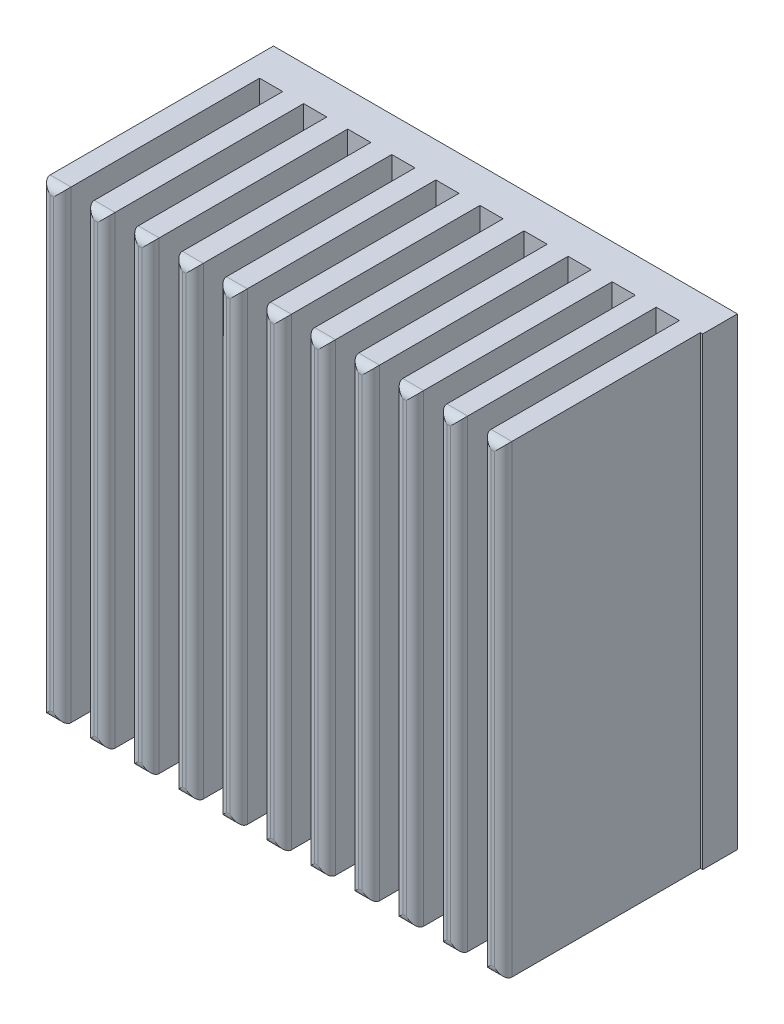
from build123d import *

# Parameters (mm, degrees)
SKETCH1_W           = 40
SKETCH1_H           = 40
BOSS_EXTRUDE1_DEPTH = 3
SKETCH2_W           = 1.8
SKETCH2_H           = 40
BOSS_EXTRUDE2_DEPTH = 17
LPATTERN1_COUNT     = 11
LPATTERN1_PITCH     = 3.8
FILLET1_R           = 0.75


with BuildPart() as part:
    # Sketch1 → Boss-Extrude1 (new body)
    with BuildSketch(Plane.XY):
        Rectangle(SKETCH1_W, SKETCH1_H)
    extrude(amount=BOSS_EXTRUDE1_DEPTH)

    # Sketch2 → Boss-Extrude2 (add)
    with BuildSketch(Plane.XY.offset(3)):
        with Locations((-19.1, 0)):
            Rectangle(SKETCH2_W, SKETCH2_H)
    boss_extrude2 = extrude(amount=BOSS_EXTRUDE2_DEPTH)

    # LPattern1: Boss-Extrude2 ×11
    with Locations(*[(i * LPATTERN1_PITCH, 0, 0) for i in range(1, LPATTERN1_COUNT)]):
        add(boss_extrude2)

    # Fillet1
    fillet1_edges = [part.edges().sort_by_distance(p)[0] for p in [
        (10.4, 0, 20),
        (11.3, -20, 20),
        (12.2, 0, 20),
        (11.3, 20, 20),
        (14.2, 0, 20),
        (15.1, -20, 20),
        (16, 0, 20),
        (15.1, 20, 20),
        (18, 0, 20),
        (18.9, -20, 20),
        (19.8, 0, 20),
        (18.9, 20, 20),
        (-20, 0, 20),
        (-19.1, -20, 20),
        (-18.2, 0, 20),
        (-19.1, 20, 20),
        (-16.2, 0, 20),
        (-15.3, -20, 20),
        (-14.4, 0, 20),
        (-15.3, 20, 20),
        (-12.4, 0, 20),
        (-11.5, -20, 20),
        (-10.6, 0, 20),
        (-11.5, 20, 20),
        (-8.6, 0, 20),
        (-7.7, -20, 20),
        (-6.8, 0, 20),
        (-7.7, 20, 20),
        (-4.8, 0, 20),
        (-3.9, -20, 20),
        (-3, 0, 20),
        (-3.9, 20, 20),
        (-1, 0, 20),
        (-0.1, -20, 20),
        (0.8, 0, 20),
        (-0.1, 20, 20),
        (2.8, 0, 20),
        (3.7, -20, 20),
        (4.6, 0, 20),
        (3.7, 20, 20),
        (6.6, 0, 20),
        (7.5, -20, 20),
        (8.4, 0, 20),
        (7.5, 20, 20),
    ]]
    fillet(fillet1_edges, radius=FILLET1_R)


solid = part.part
